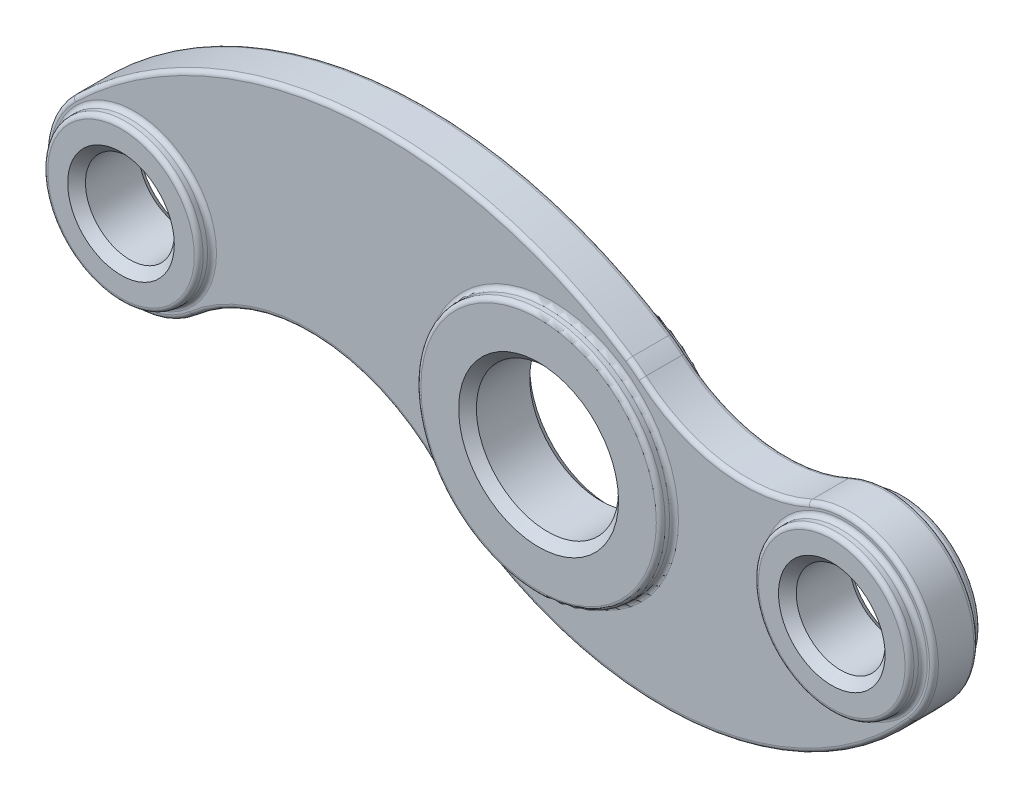
from build123d import *

# Parameters (mm, degrees)
EXTRUDE_1_DEPTH     = 5
SKETCH_3_R          = 17.5
SKETCH_3_R_2        = 27.5
EXTRUDE_2_DEPTH     = 8
SKETCH_4_R          = 10
SKETCH_4_R_2        = 16
CUT_EXTRUDE_1_DEPTH = 8
FILLET_1_R          = 1
CHAMFER_1_SIZE      = 2


with BuildPart() as part:
    # 草图1 → 凸台-拉伸1 (new, symmetric)
    with BuildSketch(Plane.XY):
        with BuildLine():
            ThreePointArc((-13.929521277, 14.351600503), (-14.732688978, -13.525822544), (13.111702128, -15.102425875))
            ThreePointArc((13.111702128, -15.102425875), (42.606871734, -5.441307783), (70.132229547, -19.782050794))
            ThreePointArc((70.132229547, -19.782050794), (73.141355211, -22.932878963), (76.5625, -25.630715826))
            ThreePointArc((76.5625, -25.630715826), (128.125, -38.032675097), (175, -13.228756555))
            ThreePointArc((175, -13.228756555), (176.054820068, 11.926556611), (151.666666667, 18.181186858))
            ThreePointArc((151.666666667, 18.181186858), (132.173851766, 15.34430318), (114.236111111, 23.484033025))
            ThreePointArc((114.236111111, 23.484033025), (112.753133172, 24.684407958), (111.199121184, 25.791282064))
            ThreePointArc((111.199121184, 25.791282064), (46.613717632, 42.17828804), (-13.929521277, 14.351600503))
        make_face()
    extrude(amount=EXTRUDE_1_DEPTH, both=True)

    # 草图3 → 凸台-拉伸2 (add, symmetric)
    with BuildSketch(Plane.XY):
        Circle(SKETCH_3_R)
        with Locations((94, 0)):
            Circle(SKETCH_3_R_2)
        with Locations((160, 0)):
            Circle(SKETCH_3_R)
    extrude(amount=EXTRUDE_2_DEPTH, both=True)

    # 草图4 → 切除-拉伸1 (cut, symmetric)
    with BuildSketch(Plane.XY):
        Circle(SKETCH_4_R)
        with Locations((94, 0)):
            Circle(SKETCH_4_R_2)
        with Locations((160, 0)):
            Circle(SKETCH_4_R)
    extrude(amount=CUT_EXTRUDE_1_DEPTH, both=True, mode=Mode.SUBTRACT)

    # 圆角1
    fillet_1_edges = [part.edges().sort_by_distance(p)[0] for p in [
        (-14.732688978, -13.525822544, -5),
        (46.613717632, 42.17828804, -5),
        (112.753133172, 24.684407958, -5),
        (132.173851766, 15.34430318, -5),
        (46.613717632, 42.17828804, 5),
        (-14.732688978, -13.525822544, 5),
        (42.606871734, -5.441307783, 5),
        (73.141355211, -22.932878963, 5),
        (-17.5, 0, -5),
        (-17.5, 0, 5),
        (-17.5, 0, -8),
        (-17.5, 0, 8),
        (128.125, -38.032675097, 5),
        (66.5, 0, -5),
        (66.5, 0, 5),
        (66.5, 0, -8),
        (66.5, 0, 8),
        (176.054820068, 11.926556611, 5),
        (142.5, 0, -5),
        (142.5, 0, 5),
        (142.5, 0, -8),
        (142.5, 0, 8),
        (132.173851766, 15.34430318, 5),
        (176.054820068, 11.926556611, -5),
        (112.753133172, 24.684407958, 5),
        (128.125, -38.032675097, -5),
        (73.141355211, -22.932878963, -5),
        (42.606871734, -5.441307783, -5),
    ]]
    fillet(fillet_1_edges, radius=FILLET_1_R)

    # 倒角1
    chamfer_1_edges = [part.edges().sort_by_distance(p)[0] for p in [
        (-10, 0, -8),
        (-10, 0, 8),
        (78, 0, -8),
        (78, 0, 8),
        (150, 0, -8),
        (150, 0, 8),
    ]]
    chamfer(chamfer_1_edges, length=CHAMFER_1_SIZE)


solid = part.part
